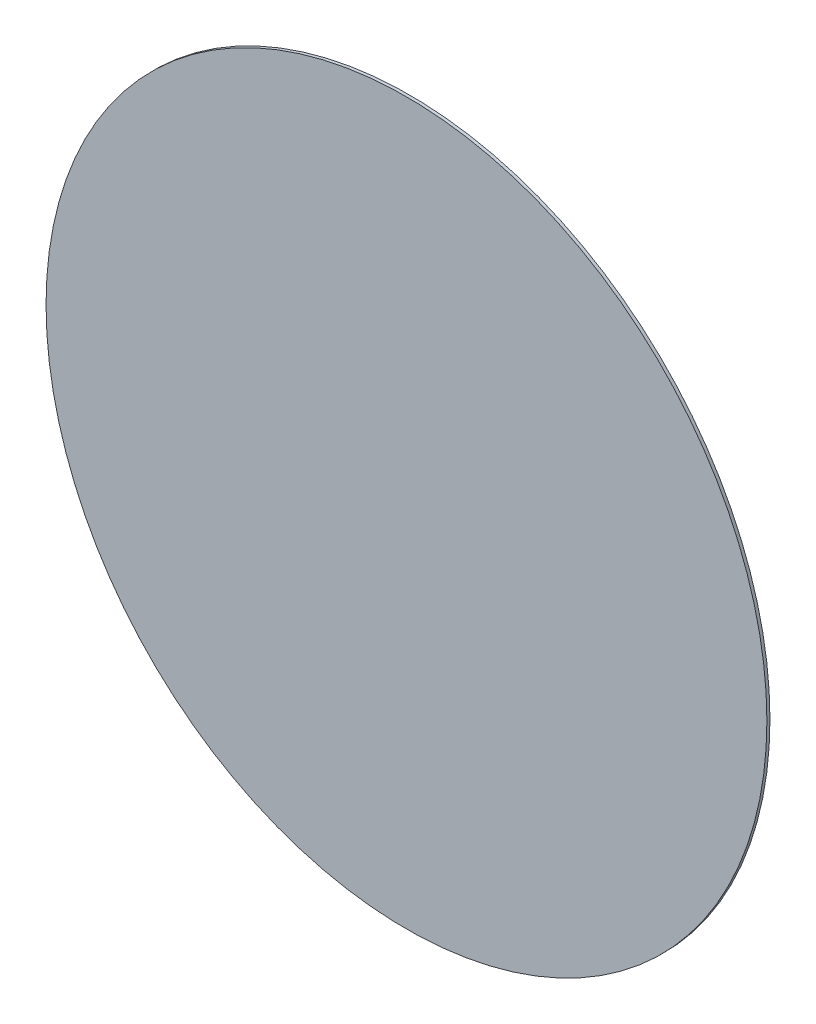
from build123d import *

# Parameters (mm, degrees)
SKETCH1_R           = 59
BOSS_EXTRUDE1_DEPTH = 0.5


with BuildPart() as part:
    # Sketch1 → Boss-Extrude1 (new body)
    with BuildSketch(Plane.XY):
        Circle(SKETCH1_R)
    extrude(amount=BOSS_EXTRUDE1_DEPTH)


solid = part.part
